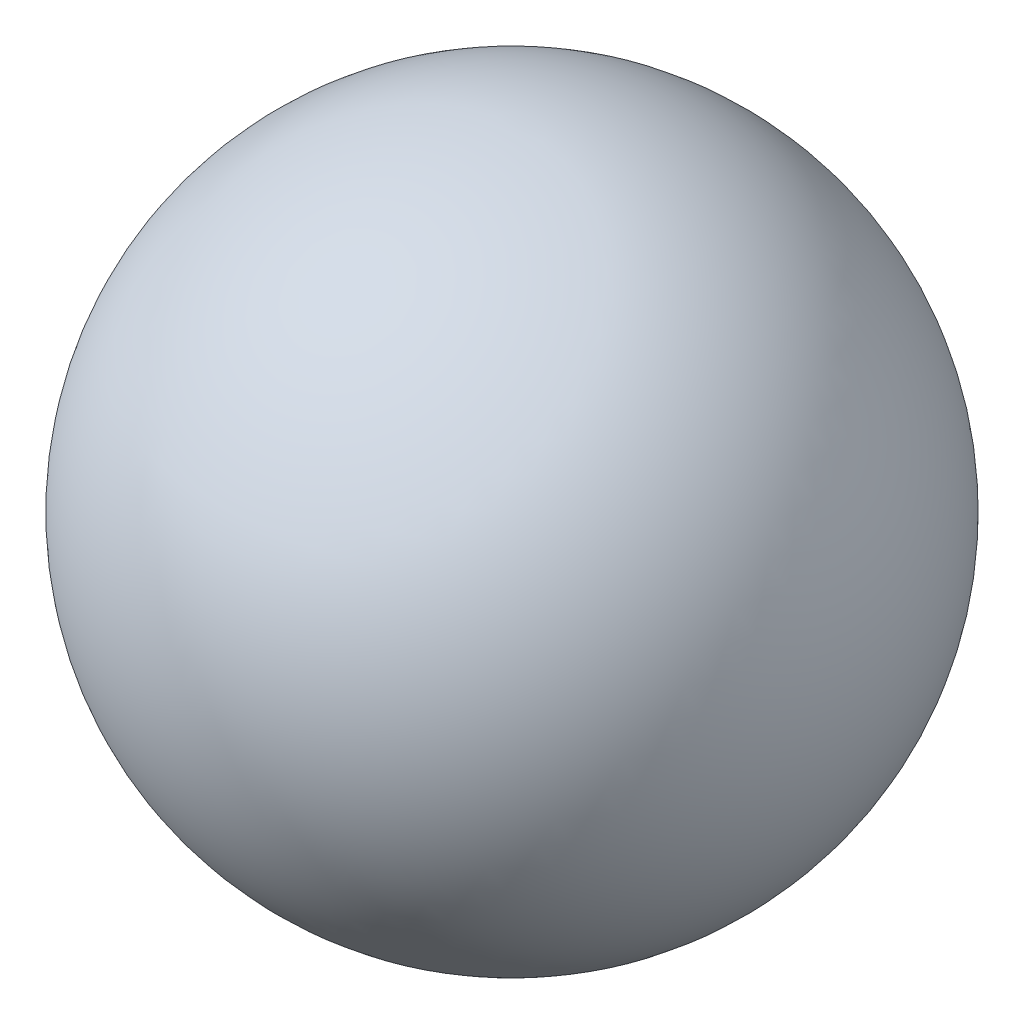
from build123d import *


with BuildPart() as part:
    # 草图1 → 旋转8 (revolve)
    with BuildSketch(Plane(origin=(0, 0, 0), x_dir=(0, 0, -1), z_dir=(1, 0, 0))):
        with BuildLine():
            Line((0, 100.1), (0, -100.1))
            ThreePointArc((0, -100.1), (-100.1, 0), (0, 100.1))
        make_face()
    revolve(axis=Axis((0, 100.1, 0), (0, -1, 0)))


solid = part.part
